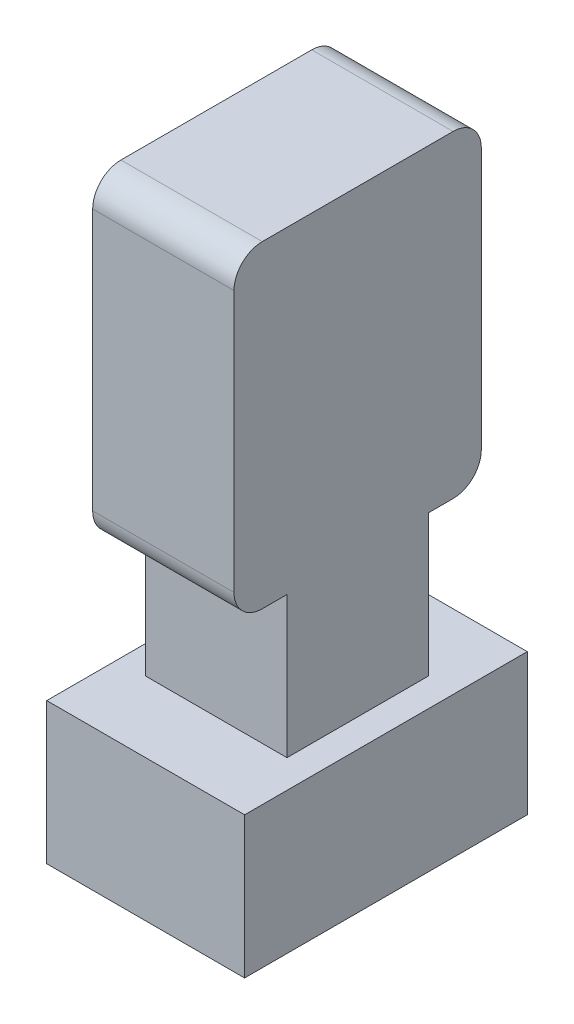
from build123d import *

# Parameters (mm, degrees)
SKETCH1_W           = 14
SKETCH1_H           = 20
BOSS_EXTRUDE1_DEPTH = 10
SKETCH2_W           = 10
SKETCH2_H           = 10
BOSS_EXTRUDE2_DEPTH = 10
BOSS_EXTRUDE3_DEPTH = 5


with BuildPart() as part:
    # Sketch1 → Boss-Extrude1 (new body)
    with BuildSketch(Plane(origin=(0, 0, 0), x_dir=(1, 0, 0), z_dir=(0, 1, 0))):
        with Locations((7, 10)):
            Rectangle(SKETCH1_W, SKETCH1_H)
    extrude(amount=BOSS_EXTRUDE1_DEPTH)

    # Sketch2 → Boss-Extrude2 (add)
    with BuildSketch(Plane(origin=(0, 10, 0), x_dir=(1, 0, 0), z_dir=(0, 1, 0))):
        with Locations((7, 10)):
            Rectangle(SKETCH2_W, SKETCH2_H)
    extrude(amount=BOSS_EXTRUDE2_DEPTH)

    # Sketch3 → Boss-Extrude3 (add, symmetric)
    with BuildSketch(Plane(origin=(7, 0, 0), x_dir=(0, 0, -1), z_dir=(1, 0, 0))):
        with BuildLine():
            Line((1.25, 22), (1.25, 40.5))
            ThreePointArc((1.25, 40.5), (1.835786438, 41.914213562), (3.25, 42.5))
            Line((3.25, 42.5), (16.75, 42.5))
            ThreePointArc((16.75, 42.5), (18.164213562, 41.914213562), (18.75, 40.5))
            Line((18.75, 40.5), (18.75, 22))
            ThreePointArc((18.75, 22), (18.164213562, 20.585786438), (16.75, 20))
            Line((16.75, 20), (3.25, 20))
            ThreePointArc((3.25, 20), (1.835786438, 20.585786438), (1.25, 22))
        make_face()
    extrude(amount=BOSS_EXTRUDE3_DEPTH, both=True)


solid = part.part
